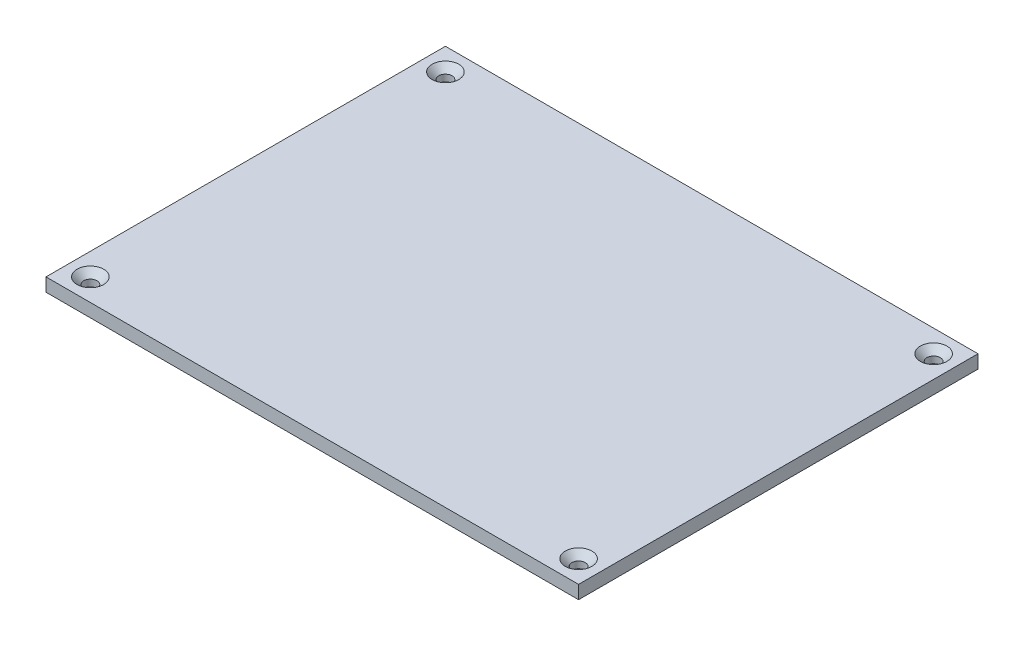
from build123d import *

# Parameters (mm, degrees)
SKETCH1_W           = 120
SKETCH1_H           = 90
SKETCH1_R           = 1.5
BOSS_EXTRUDE1_DEPTH = 3
CHAMFER1_SIZE       = 1.5


with BuildPart() as part:
    # Sketch1 → Boss-Extrude1 (new body)
    with BuildSketch(Plane(origin=(0, 0, 0), x_dir=(1, 0, 0), z_dir=(0, 1, 0))):
        Rectangle(SKETCH1_W, SKETCH1_H)
        with Locations(Location((-55, 40, 0), (0, 0, 270))):
            Circle(SKETCH1_R, mode=Mode.SUBTRACT)
        with Locations(Location((-55, -40, 0), (0, 0, 270))):
            Circle(SKETCH1_R, mode=Mode.SUBTRACT)
        with Locations(Location((55, -40, 0), (0, 0, 270))):
            Circle(SKETCH1_R, mode=Mode.SUBTRACT)
        with Locations(Location((55, 40, 0), (0, 0, 270))):
            Circle(SKETCH1_R, mode=Mode.SUBTRACT)
    extrude(amount=BOSS_EXTRUDE1_DEPTH)

    # Chamfer1
    chamfer1_edges = [part.edges().sort_by_distance(p)[0] for p in [
        (-55, 3, -41.5),
        (-55, 3, 38.5),
        (55, 3, 38.5),
        (55, 3, -41.5),
    ]]
    chamfer(chamfer1_edges, length=CHAMFER1_SIZE)


solid = part.part
